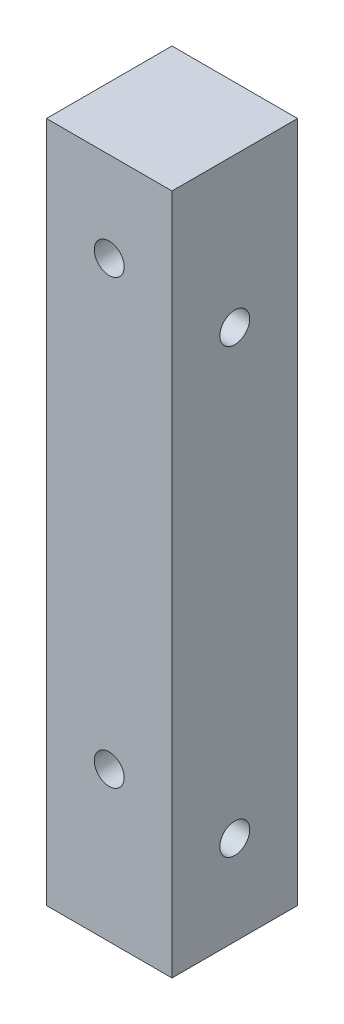
from build123d import *

# Parameters (mm, degrees)
SKETCH1_W           = 21
SKETCH1_H           = 21
BOSS_EXTRUDE1_DEPTH = 114
SKETCH3_R           = 2.5
CUT_EXTRUDE1_DEPTH  = 117.392654407
SKETCH4_R           = 2.5
CUT_EXTRUDE2_DEPTH  = 117.392654407


with BuildPart() as part:
    # Sketch1 → Boss-Extrude1 (new body)
    with BuildSketch(Plane(origin=(0, 0, 0), x_dir=(1, 0, 0), z_dir=(0, 1, 0))):
        Rectangle(SKETCH1_W, SKETCH1_H)
    extrude(amount=BOSS_EXTRUDE1_DEPTH)

    # Sketch3 → Cut-Extrude1 (cut, through all)
    with BuildSketch(Plane.XY.offset(10.5)):
        with Locations((0, 99)):
            Circle(SKETCH3_R)
        with Locations((0, 25)):
            Circle(SKETCH3_R)
    extrude(amount=-CUT_EXTRUDE1_DEPTH, mode=Mode.SUBTRACT)

    # Sketch4 → Cut-Extrude2 (cut, through all)
    with BuildSketch(Plane(origin=(10.5, 0, 0), x_dir=(0, 0, -1), z_dir=(1, 0, 0))):
        with Locations((0, 89)):
            Circle(SKETCH4_R)
        with Locations((0, 15)):
            Circle(SKETCH4_R)
    extrude(amount=-CUT_EXTRUDE2_DEPTH, mode=Mode.SUBTRACT)


solid = part.part
